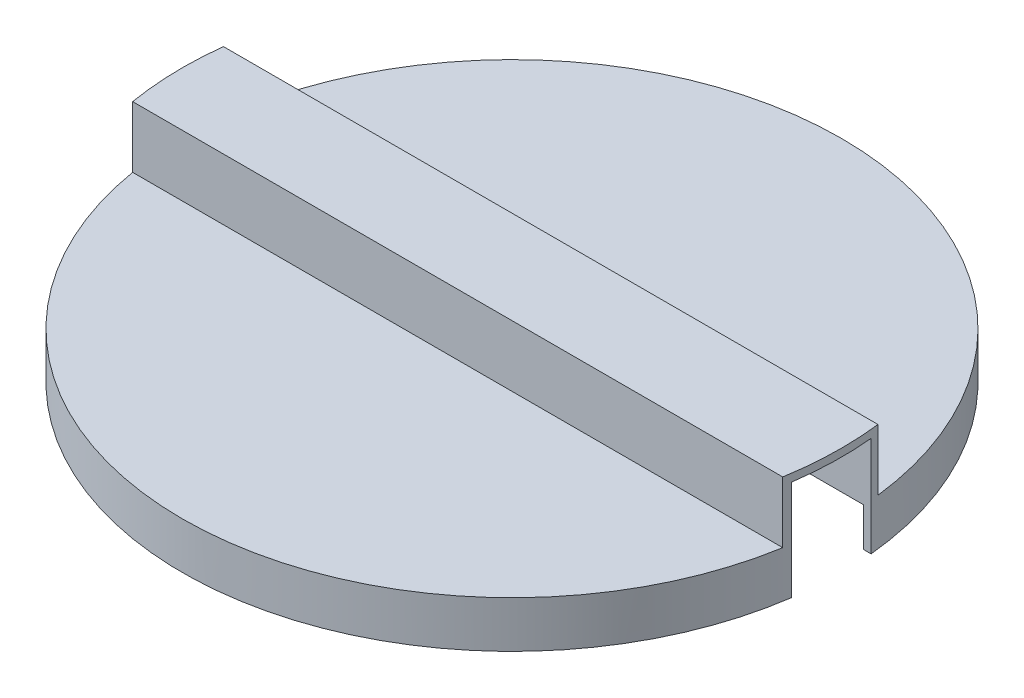
from build123d import *
from build123d.topology import SkipClean

# Parameters (mm, degrees)
BOSS_EXTRUDE1_DEPTH   = 3
BOSS_EXTRUDE1_2_DEPTH = 3
BOSS_EXTRUDE2_DEPTH   = 20.7
BOSS_EXTRUDE3_DEPTH   = 3
BOSS_EXTRUDE4_START   = 15
BOSS_EXTRUDE4_DEPTH   = 15


with BuildPart() as part:
    # Sketch1 → Boss-Extrude1 (new body)
    with BuildSketch(Plane(origin=(0, 0, 0), x_dir=(1, 0, 0), z_dir=(0, 1, 0))):
        with BuildLine():
            Line((-126.934037988, 12), (126.934037988, 12))
            ThreePointArc((126.934037988, 12), (0, 127.5), (-126.934037988, 12))
        make_face()
    extrude(amount=BOSS_EXTRUDE1_DEPTH)



with BuildPart() as body_2:
    # Sketch1 → Boss-Extrude1 2 (new body)
    with BuildSketch(Plane(origin=(0, 0, 0), x_dir=(1, 0, 0), z_dir=(0, 1, 0))):
        with BuildLine():
            Line((-126.223016918, -18), (126.223016918, -18))
            ThreePointArc((126.223016918, -18), (0, -127.5), (-126.223016918, -18))
        make_face()
    extrude(amount=BOSS_EXTRUDE1_2_DEPTH)


with BuildPart() as part_1:
    with SkipClean():  # the faces are left unmerged after this step: merging them gives an invalid solid
        add(part.part)

        add(body_2.part)  # Boss-Extrude2 merges body 2
        # Sketch5 → Boss-Extrude2 (add)
        with BuildSketch(Plane(origin=(0, 3, 0), x_dir=(1, 0, 0), z_dir=(0, 1, 0))):
            with BuildLine():
                Line((-126.614572621, 15), (126.614572621, 15))
                ThreePointArc((126.614572621, 15), (126.783179032, 13.50094495), (126.934037988, 12))
                Line((126.934037988, 12), (-126.934037988, 12))
                ThreePointArc((-126.934037988, 12), (-126.783179032, 13.50094495), (-126.614572621, 15))
            make_face()
            with BuildLine():
                Line((-125.758697512, -21), (125.758697512, -21))
                ThreePointArc((125.758697512, -21), (125.999786118, -19.501381954), (126.223016918, -18))
                Line((126.223016918, -18), (-126.223016918, -18))
                ThreePointArc((-126.223016918, -18), (-125.999786118, -19.501381954), (-125.758697512, -21))
            make_face()
        extrude(amount=BOSS_EXTRUDE2_DEPTH)

    # Sketch6 → Boss-Extrude3 (add)
    with BuildSketch(Plane(origin=(0, 23.7, 0), x_dir=(1, 0, 0), z_dir=(0, 1, 0))):
        with BuildLine():
            Line((-126.614572621, 15), (126.614572621, 15))
            ThreePointArc((126.614572621, 15), (127.463982636, -3.030368055), (125.758697512, -21))
            Line((125.758697512, -21), (-125.758697512, -21))
            ThreePointArc((-125.758697512, -21), (-127.463982636, -3.030368055), (-126.614572621, 15))
        make_face()
    extrude(amount=BOSS_EXTRUDE3_DEPTH)

    # Sketch7 → Boss-Extrude4 (add)
    with BuildSketch(Plane.XZ.offset(BOSS_EXTRUDE4_START)):
        with BuildLine():
            Line((-126.934037988, -12), (-123.977391141, -12))
            ThreePointArc((-123.977391141, -12), (0, -124.55678831), (123.977391141, -12))
            Line((123.977391141, -12), (126.934037988, -12))
            ThreePointArc((126.934037988, -12), (0, -127.5), (-126.934037988, -12))
        make_face()
        with BuildLine():
            Line((123.191923437, 18), (126.223016918, 18))
            ThreePointArc((126.223016918, 18), (0, 127.5), (-126.223016918, 18))
            Line((-126.223016918, 18), (-123.191923437, 18))
            ThreePointArc((-123.191923437, 18), (0, 124.5), (123.191923437, 18))
        make_face()
    extrude(amount=-BOSS_EXTRUDE4_DEPTH)


solid = part_1.part
